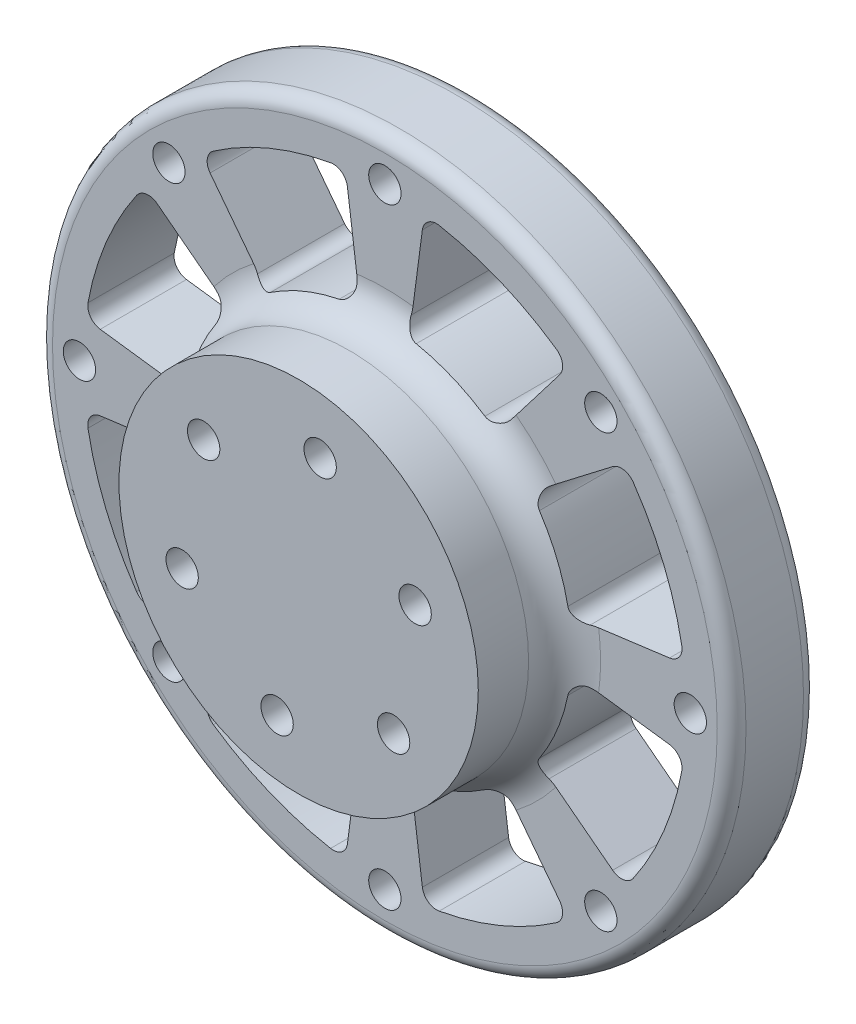
from build123d import *

# Parameters (mm, degrees)
SKETCH_6_R          = 48.25
SKETCH_6_R_2        = 2.25
EXTRUDE_4_DEPTH     = 12
SKETCH_7_R          = 25
SKETCH_7_R_2        = 2.25
EXTRUDE_5_DEPTH     = 12
CUT_EXTRUDE_START   = -35
SKETCH_8_R          = 2.25
CUT_EXTRUDE_6_DEPTH = 35
FILLET_1_R          = 5
CUT_EXTRUDE_7_DEPTH = 35
FILLET_2_R          = 2


with BuildPart() as part:
    # 草图6 → 凸台-拉伸4 (new body)
    with BuildSketch(Plane.XY):
        Circle(SKETCH_6_R)
        with Locations((0, 42.5)):
            Circle(SKETCH_6_R_2, mode=Mode.SUBTRACT)
        with Locations((30.0520382, 30.0520382)):
            Circle(SKETCH_6_R_2, mode=Mode.SUBTRACT)
        with Locations((42.5, 0)):
            Circle(SKETCH_6_R_2, mode=Mode.SUBTRACT)
        with Locations((30.0520382, -30.0520382)):
            Circle(SKETCH_6_R_2, mode=Mode.SUBTRACT)
        with Locations((0, -42.5)):
            Circle(SKETCH_6_R_2, mode=Mode.SUBTRACT)
        with Locations((-30.0520382, -30.0520382)):
            Circle(SKETCH_6_R_2, mode=Mode.SUBTRACT)
        with Locations((-42.5, 0)):
            Circle(SKETCH_6_R_2, mode=Mode.SUBTRACT)
        with Locations((-30.0520382, 30.0520382)):
            Circle(SKETCH_6_R_2, mode=Mode.SUBTRACT)
    extrude(amount=EXTRUDE_4_DEPTH)

    # 草图7 → 凸台-拉伸5 (add)
    with BuildSketch(Plane.XY.offset(12)):
        Circle(SKETCH_7_R)
        with Locations((2.995431065, 16.987933739)):
            Circle(SKETCH_7_R_2, mode=Mode.SUBTRACT)
        with Locations((16.209697709, 5.899847472)):
            Circle(SKETCH_7_R_2, mode=Mode.SUBTRACT)
        with Locations((13.214266644, -11.088086267)):
            Circle(SKETCH_7_R_2, mode=Mode.SUBTRACT)
        with Locations((-2.995431065, -16.987933739)):
            Circle(SKETCH_7_R_2, mode=Mode.SUBTRACT)
        with Locations((-16.209697709, -5.899847472)):
            Circle(SKETCH_7_R_2, mode=Mode.SUBTRACT)
        with Locations((-13.214266644, 11.088086267)):
            Circle(SKETCH_7_R_2, mode=Mode.SUBTRACT)
    extrude(amount=EXTRUDE_5_DEPTH)

    # 草图8 → 切除-拉伸6 (cut)
    with BuildSketch(Plane.XY.offset(24).offset(CUT_EXTRUDE_START)):
        with Locations((-13.214266644, 11.088086267)):
            Circle(SKETCH_8_R)
        with Locations((2.995431065, 16.987933739)):
            Circle(SKETCH_8_R)
        with Locations((16.209697709, 5.899847472)):
            Circle(SKETCH_8_R)
        with Locations((13.214266644, -11.088086267)):
            Circle(SKETCH_8_R)
        with Locations((-2.995431065, -16.987933739)):
            Circle(SKETCH_8_R)
        with Locations((-16.209697709, -5.899847472)):
            Circle(SKETCH_8_R)
    extrude(amount=CUT_EXTRUDE_6_DEPTH, mode=Mode.SUBTRACT)

    # 圆角1
    fillet_1_edges = [part.edges().sort_by_distance(p)[0] for p in [
        (-25, 0, 12),
    ]]
    fillet(fillet_1_edges, radius=FILLET_1_R)

    # 草图9 → 切除-拉伸7 (cut)
    with BuildSketch(Plane(origin=(0, 0, 0), x_dir=(-1, 0, 0), z_dir=(0, 0, -1))):
        with BuildLine():
            ThreePointArc((-16.436558583, 21.420540188), (-10.332452674, 24.944747378), (-3.52420719, 26.769011257))
            Line((-3.52420719, 26.769011257), (-5.482100073, 41.640684178))
            ThreePointArc((-5.482100073, 41.640684178), (-16.072704159, 38.802940365), (-25.567980018, 33.320840292))
            Line((-25.567980018, 33.320840292), (-16.436558583, 21.420540188))
        make_face()
        with BuildLine():
            Line((5.482100073, 41.640684178), (3.52420719, 26.769011257))
            ThreePointArc((3.52420719, 26.769011257), (10.332452674, 24.944747378), (16.436558583, 21.420540188))
            Line((16.436558583, 21.420540188), (25.567980018, 33.320840292))
            ThreePointArc((25.567980018, 33.320840292), (16.072704159, 38.802940365), (5.482100073, 41.640684178))
        make_face()
        with BuildLine():
            Line((33.320840292, 25.567980018), (21.420540188, 16.436558583))
            ThreePointArc((21.420540188, 16.436558583), (24.944747378, 10.332452674), (26.769011257, 3.52420719))
            Line((26.769011257, 3.52420719), (41.640684178, 5.482100073))
            ThreePointArc((41.640684178, 5.482100073), (38.802940365, 16.072704159), (33.320840292, 25.567980018))
        make_face()
        with BuildLine():
            Line((41.640684178, -5.482100073), (26.769011257, -3.52420719))
            ThreePointArc((26.769011257, -3.52420719), (24.944747378, -10.332452674), (21.420540188, -16.436558583))
            Line((21.420540188, -16.436558583), (33.320840292, -25.567980018))
            ThreePointArc((33.320840292, -25.567980018), (38.802940365, -16.072704159), (41.640684178, -5.482100073))
        make_face()
        with BuildLine():
            Line((25.567980018, -33.320840292), (16.436558583, -21.420540188))
            ThreePointArc((16.436558583, -21.420540188), (10.332452674, -24.944747378), (3.52420719, -26.769011257))
            Line((3.52420719, -26.769011257), (5.482100073, -41.640684178))
            ThreePointArc((5.482100073, -41.640684178), (16.072704159, -38.802940365), (25.567980018, -33.320840292))
        make_face()
        with BuildLine():
            Line((-5.482100073, -41.640684178), (-3.52420719, -26.769011257))
            ThreePointArc((-3.52420719, -26.769011257), (-10.332452674, -24.944747378), (-16.436558583, -21.420540188))
            Line((-16.436558583, -21.420540188), (-25.567980018, -33.320840292))
            ThreePointArc((-25.567980018, -33.320840292), (-16.072704159, -38.802940365), (-5.482100073, -41.640684178))
        make_face()
        with BuildLine():
            Line((-33.320840292, -25.567980018), (-21.420540188, -16.436558583))
            ThreePointArc((-21.420540188, -16.436558583), (-24.944747378, -10.332452674), (-26.769011257, -3.52420719))
            Line((-26.769011257, -3.52420719), (-41.640684178, -5.482100073))
            ThreePointArc((-41.640684178, -5.482100073), (-38.802940365, -16.072704159), (-33.320840292, -25.567980018))
        make_face()
        with BuildLine():
            Line((-41.640684178, 5.482100073), (-26.769011257, 3.52420719))
            ThreePointArc((-26.769011257, 3.52420719), (-24.944747378, 10.332452674), (-21.420540188, 16.436558583))
            Line((-21.420540188, 16.436558583), (-33.320840292, 25.567980018))
            ThreePointArc((-33.320840292, 25.567980018), (-38.802940365, 16.072704159), (-41.640684178, 5.482100073))
        make_face()
    extrude(amount=-CUT_EXTRUDE_7_DEPTH, mode=Mode.SUBTRACT)

    # 圆角2
    fillet_2_edges = [part.edges().sort_by_distance(p)[0] for p in [
        (-48.25, 0, 0),
        (21.420540188, 16.436558583, 6.5),
        (26.769011257, 3.52420719, 6.5),
        (41.640684178, 5.482100073, 6),
        (33.320840292, 25.567980018, 6),
        (16.436558583, -21.420540188, 6.5),
        (3.52420719, -26.769011257, 6.5),
        (5.482100073, -41.640684178, 6),
        (25.567980018, -33.320840292, 6),
        (26.769011257, -3.52420719, 6.5),
        (21.420540188, -16.436558583, 6.5),
        (33.320840292, -25.567980018, 6),
        (41.640684178, -5.482100073, 6),
        (-21.420540188, -16.436558583, 6.5),
        (-26.769011257, -3.52420719, 6.5),
        (-41.640684178, -5.482100073, 6),
        (-33.320840292, -25.567980018, 6),
        (-3.52420719, -26.769011257, 6.5),
        (-16.436558583, -21.420540188, 6.5),
        (-25.567980018, -33.320840292, 6),
        (-5.482100073, -41.640684178, 6),
        (-16.436558583, 21.420540188, 6.5),
        (-3.52420719, 26.769011257, 6.5),
        (-5.482100073, 41.640684178, 6),
        (-25.567980018, 33.320840292, 6),
        (-26.769011257, 3.52420719, 6.5),
        (-21.420540188, 16.436558583, 6.5),
        (-33.320840292, 25.567980018, 6),
        (-41.640684178, 5.482100073, 6),
        (3.52420719, 26.769011257, 6.5),
        (16.436558583, 21.420540188, 6.5),
        (25.567980018, 33.320840292, 6),
        (5.482100073, 41.640684178, 6),
        (-48.25, 0, 12),
    ]]
    fillet(fillet_2_edges, radius=FILLET_2_R)


solid = part.part
